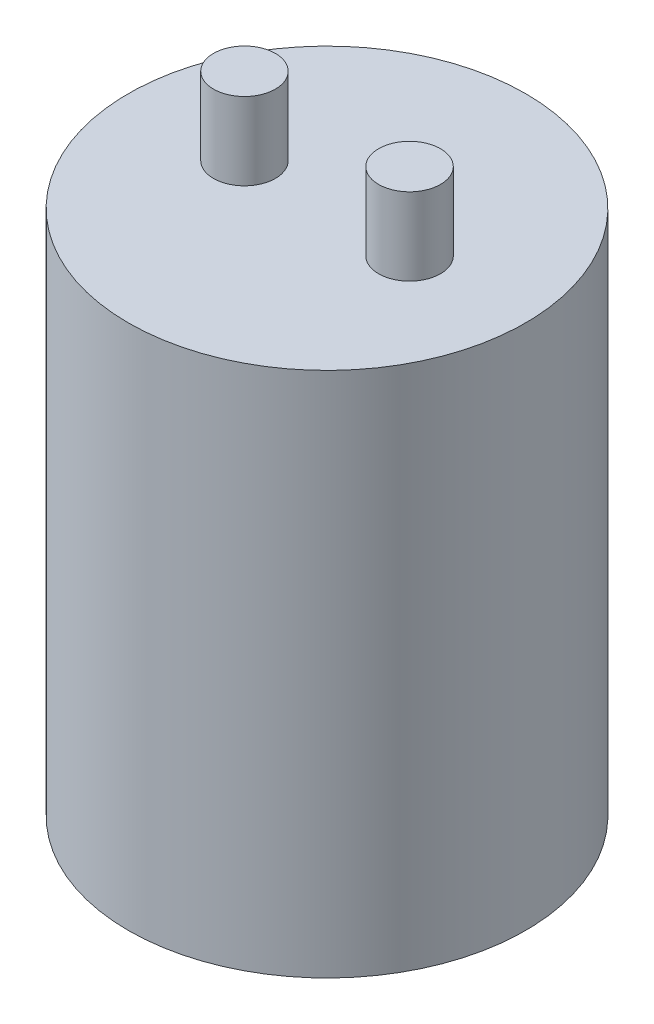
from build123d import *

# Parameters (mm, degrees)
SKETCH_1_R      = 38.5
EXTRUDE_1_DEPTH = 51
SKETCH_2_R      = 6
EXTRUDE_2_DEPTH = 15


with BuildPart() as part:
    # 草图1 → 凸台-拉伸1 (new, symmetric)
    with BuildSketch(Plane(origin=(0, 0, 0), x_dir=(1, 0, 0), z_dir=(0, 1, 0))):
        with Locations(Location((0, 0, 0), (0, 0, 270))):
            Circle(SKETCH_1_R)
    extrude(amount=EXTRUDE_1_DEPTH, both=True)

    # 草图2 → 凸台-拉伸2 (add)
    with BuildSketch(Plane(origin=(0, 51, 0), x_dir=(1, 0, 0), z_dir=(0, 1, 0))):
        with Locations(Location((16, 0, 0), (0, 0, 270))):
            Circle(SKETCH_2_R)
        with Locations(Location((-16, 0, 0), (0, 0, 90))):
            Circle(SKETCH_2_R)
    extrude(amount=EXTRUDE_2_DEPTH)


solid = part.part
